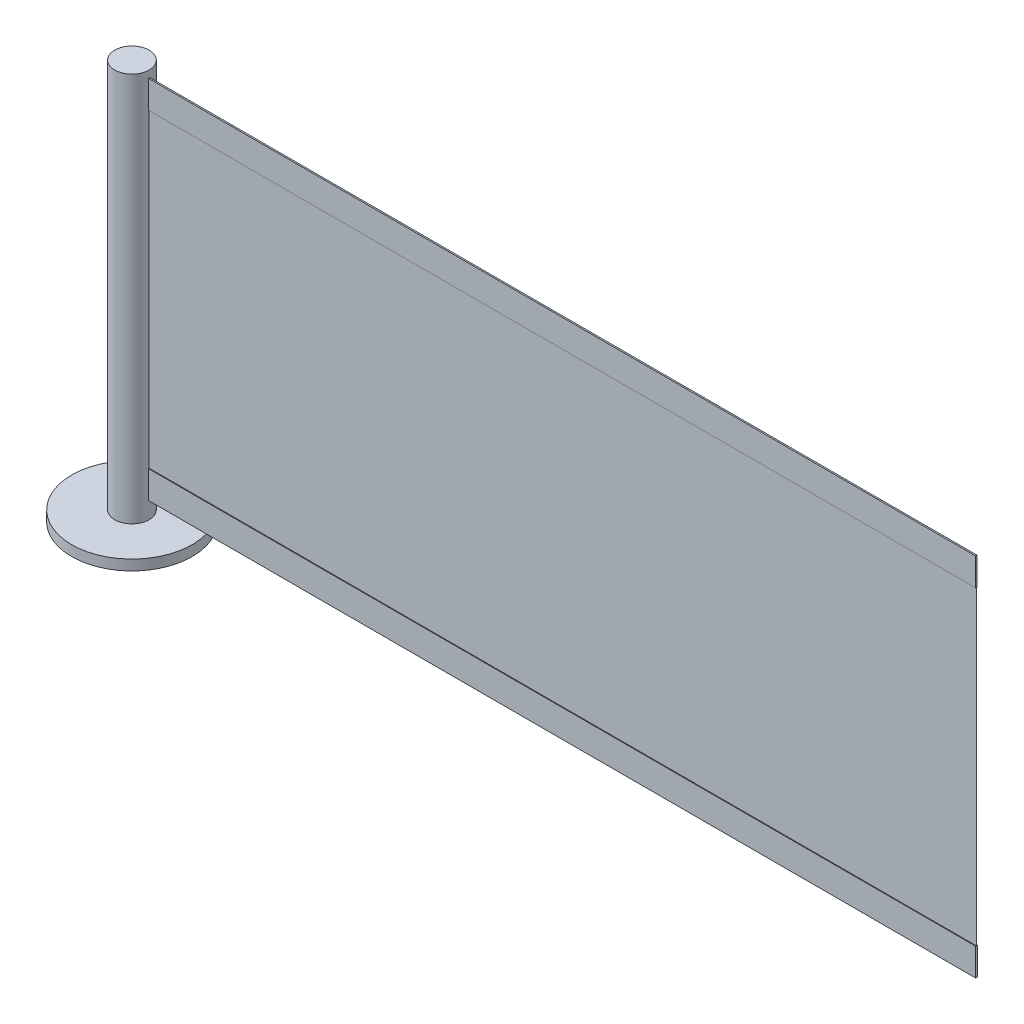
from build123d import *

# Parameters (mm, degrees)
SKETCH2_R           = 175
BOSS_EXTRUDE1_DEPTH = 30
SKETCH3_R           = 50
BOSS_EXTRUDE2_DEPTH = 1110
SKETCH7_W           = 2450
SKETCH7_H           = 1
BOSS_EXTRUDE3_DEPTH = 1060
SKETCH8_W           = 2450
SKETCH8_H           = 4
BOSS_EXTRUDE4_DEPTH = 80
SKETCH11_W          = 2450
SKETCH11_H          = 4.938385514
BOSS_EXTRUDE5_DEPTH = 80
SKETCH12_R          = 50
BOSS_EXTRUDE6_DEPTH = 20


with BuildPart() as part:
    # Sketch2 → Boss-Extrude1 (new body)
    with BuildSketch(Plane(origin=(0, 0, 0), x_dir=(1, 0, 0), z_dir=(0, 1, 0))):
        with Locations(Location((0, 0, 0), (0, 0, 270))):
            Circle(SKETCH2_R)
    extrude(amount=BOSS_EXTRUDE1_DEPTH)

    # Sketch3 → Boss-Extrude2 (add)
    with BuildSketch(Plane(origin=(0, 30, 0), x_dir=(1, 0, 0), z_dir=(0, 1, 0))):
        with Locations(Location((0, 0, 0), (0, 0, 270))):
            Circle(SKETCH3_R)
    extrude(amount=BOSS_EXTRUDE2_DEPTH)

    # Sketch7 → Boss-Extrude3 (add)
    with BuildSketch(Plane(origin=(0, 1140, 0), x_dir=(1, 0, 0), z_dir=(0, 1, 0))):
        with Locations((1225, 0)):
            Rectangle(SKETCH7_W, SKETCH7_H)
    extrude(amount=-BOSS_EXTRUDE3_DEPTH)

    # Sketch8 → Boss-Extrude4 (add)
    with BuildSketch(Plane(origin=(0, 1140, 0), x_dir=(1, 0, 0), z_dir=(0, 1, 0))):
        with Locations((1225, 0)):
            Rectangle(SKETCH8_W, SKETCH8_H)
    extrude(amount=-BOSS_EXTRUDE4_DEPTH)

    # Sketch11 → Boss-Extrude5 (add)
    with BuildSketch(Plane(origin=(0, 80, 0), x_dir=(-1, 0, 0), z_dir=(0, -1, 0))):
        with Locations((-1225, 0)):
            Rectangle(SKETCH11_W, SKETCH11_H)
    extrude(amount=-BOSS_EXTRUDE5_DEPTH)

    # Sketch12 → Boss-Extrude6 (add)
    with BuildSketch(Plane(origin=(0, 1140, 0), x_dir=(1, 0, 0), z_dir=(0, 1, 0))):
        with Locations(Location((0, 0, 0), (0, 0, 270))):
            Circle(SKETCH12_R)
    extrude(amount=BOSS_EXTRUDE6_DEPTH)


solid = part.part
